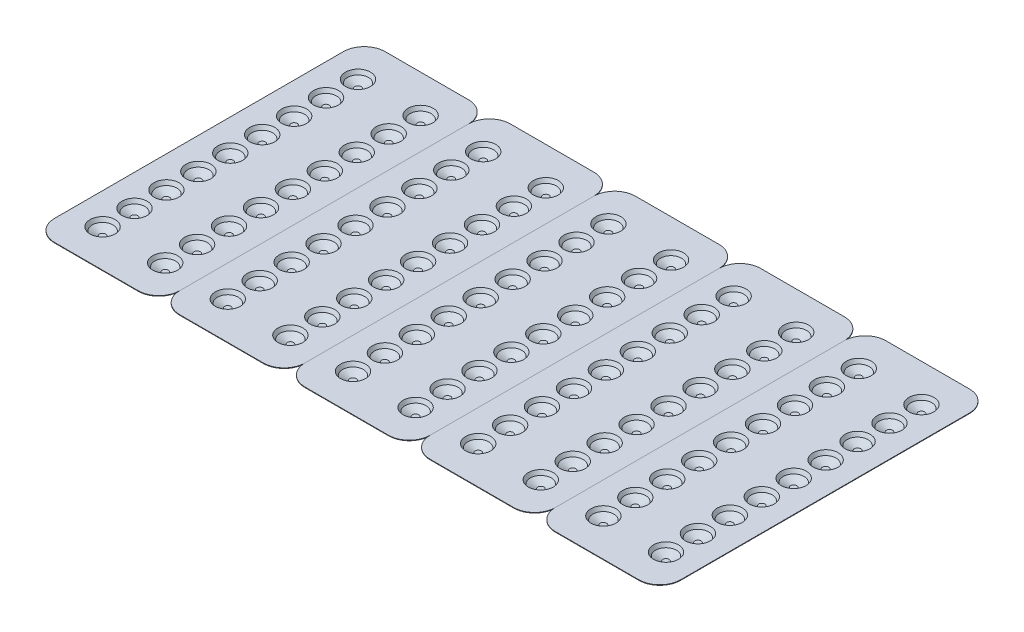
from build123d import *

# Parameters (mm, degrees)
DODANIE_WYCI_GNI_CIE1_DEPTH = 0.25
SZKIC2_R                    = 6
WYTNIJ_WYCI_GNI_CIE1_DEPTH  = 85.692377506
SZYK_LINIOWY4_COUNT         = 9
SZYK_LINIOWY4_PITCH         = 15.300152
SZYK_LINIOWY4_COUNT_DIR2    = 2
SZYK_LINIOWY4_PITCH_DIR2    = 30
SZYK_LINIOWY5_COUNT         = 5
SZYK_LINIOWY5_PITCH         = 60


with BuildPart() as part:
    # Szkic1 → Dodanie-wyciągnięcie1 (new body)
    with BuildSketch(Plane(origin=(0, 0, 0), x_dir=(1, 0, 0), z_dir=(0, 1, 0))):
        with BuildLine():
            Line((-20, 79.200608), (20, 79.200608))
            ThreePointArc((20, 79.200608), (27.071067812, 76.271675812), (30, 69.200608))
            Line((30, 69.200608), (30, -69.200608))
            ThreePointArc((30, -69.200608), (27.071067812, -76.271675812), (20, -79.200608))
            Line((20, -79.200608), (-20, -79.200608))
            ThreePointArc((-20, -79.200608), (-27.071067812, -76.271675812), (-30, -69.200608))
            Line((-30, -69.200608), (-30, 69.200608))
            ThreePointArc((-30, 69.200608), (-27.071067812, 76.271675812), (-20, 79.200608))
        make_face()
    extrude(amount=DODANIE_WYCI_GNI_CIE1_DEPTH)

    # Szkic2 → Wytnij-wyciągnięcie1 (cut, through all)
    with BuildSketch(Plane(origin=(0, 0, 0), x_dir=(1, 0, 0), z_dir=(0, 1, 0))):
        with Locations(Location((-15, -61.200608, 0), (0, 0, 270))):
            Circle(SZKIC2_R)
    wytnij_wyci_gni_cie1 = extrude(amount=WYTNIJ_WYCI_GNI_CIE1_DEPTH, mode=Mode.SUBTRACT)

    # Szkic3 → Obrót-cienka ścianka1 (revolve)
    with BuildSketch(Plane(origin=(-15, 0, 0), x_dir=(0, 0, -1), z_dir=(1, 0, 0)), mode=Mode.PRIVATE) as obr_t_cienka_cianka1_sk:
        Polygon((-55.200608, 0.25), (-56.198203264, -1.477885683), (-59.700608, -3.5), (-61.200608, -3.5), (-61.200608, -3.65), (-59.660415621, -3.65), (-56.088395643, -1.587693304), (-55.070704189, 0.175), align=None)
    obr_t_cienka_cianka1 = revolve(obr_t_cienka_cianka1_sk.sketch.rotate(Axis((-15, 0.900321887, 61.200608), (0, -1, 0)), 180), axis=Axis((-15, 0.900321887, 61.200608), (0, -1, 0)))

    # Szyk liniowy4: Wytnij-wyciągnięcie1, Obr_t-cienka _cianka1 9 × 2
    with Locations(*[(j * SZYK_LINIOWY4_PITCH_DIR2, 0, -i * SZYK_LINIOWY4_PITCH) for i in range(SZYK_LINIOWY4_COUNT) for j in range(SZYK_LINIOWY4_COUNT_DIR2) if (i, j) != (0, 0)]):
        add(wytnij_wyci_gni_cie1, mode=Mode.SUBTRACT)
        add(obr_t_cienka_cianka1)


with BuildPart() as szyk_liniowy5_1:
    # Szyk liniowy5: pattern copy
    add(part.part.moved(Location(Vector(1, 0, 0) * (1 * SZYK_LINIOWY5_PITCH))))


with BuildPart() as szyk_liniowy5_2:
    # Szyk liniowy5: pattern copy
    add(part.part.moved(Location(Vector(1, 0, 0) * (2 * SZYK_LINIOWY5_PITCH))))


with BuildPart() as szyk_liniowy5_3:
    # Szyk liniowy5: pattern copy
    add(part.part.moved(Location(Vector(1, 0, 0) * (3 * SZYK_LINIOWY5_PITCH))))


with BuildPart() as szyk_liniowy5_4:
    # Szyk liniowy5: pattern copy
    add(part.part.moved(Location(Vector(1, 0, 0) * (4 * SZYK_LINIOWY5_PITCH))))


solid = Compound([part.part, szyk_liniowy5_1.part, szyk_liniowy5_2.part, szyk_liniowy5_3.part, szyk_liniowy5_4.part])
